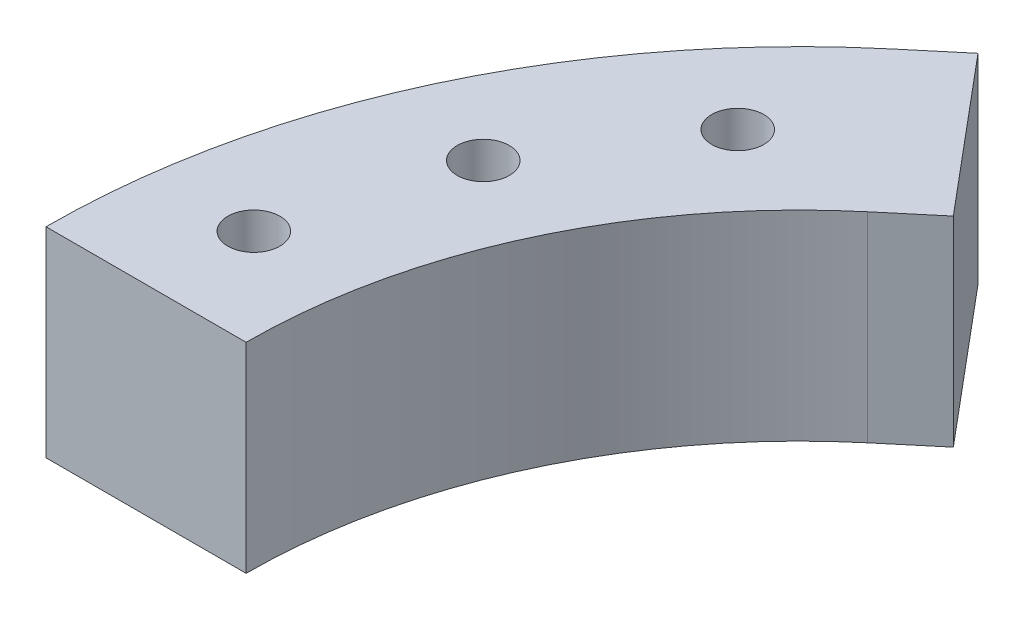
from build123d import *

# Parameters (mm, degrees)
SKETCH1_R           = 2.6
BOSS_EXTRUDE1_DEPTH = 20
BOSS_EXTRUDE2_DEPTH = 20


with BuildPart() as part:
    # Sketch1 → Boss-Extrude1 (new body)
    with BuildSketch(Plane(origin=(0, 0, 0), x_dir=(1, 0, 0), z_dir=(0, 1, 0))):
        with BuildLine():
            Line((10, 0), (-10, 0))
            ThreePointArc((-10, 0), (-2.947752983, 31.810630591), (16.887506811, 57.660444431))
            Line((16.887506811, 57.660444431), (29.743259005, 42.339555569))
            ThreePointArc((29.743259005, 42.339555569), (15.178402758, 23.358265357), (10, 0))
        make_face()
        with Locations(Location((0.770593323, 10, 0), (0, 0, 270))):
            Circle(SKETCH1_R, mode=Mode.SUBTRACT)
        with Locations(Location((6.115324888, 27.584447974, 0), (0, 0, 270))):
            Circle(SKETCH1_R, mode=Mode.SUBTRACT)
        with Locations(Location((16.150266317, 42.98181517, 0), (0, 0, 270))):
            Circle(SKETCH1_R, mode=Mode.SUBTRACT)
    extrude(amount=BOSS_EXTRUDE1_DEPTH)

    # Sketch2 → Boss-Extrude2 (add)
    with BuildSketch(Plane(origin=(0, 20, 0), x_dir=(1, 0, 0), z_dir=(0, 1, 0))):
        Polygon((16.887506811, 57.660444431), (29.743259005, 42.339555569), (34.416130108, 46.260559988), (21.560377914, 61.58144885), align=None)
    extrude(amount=-BOSS_EXTRUDE2_DEPTH)


solid = part.part
